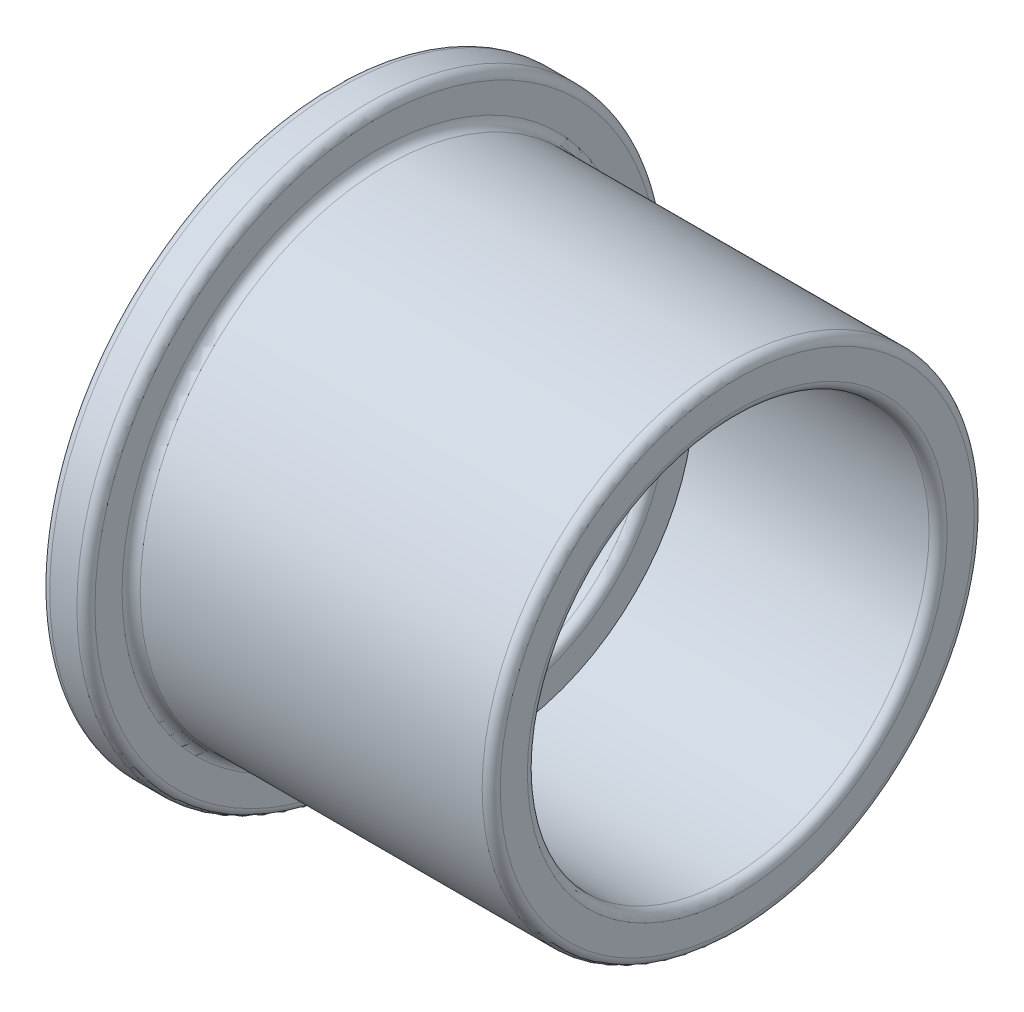
from build123d import *

# Parameters (mm, degrees)
FILLET1_R = 0.5


with BuildPart() as part:
    # Sketch1 → Revolve1 (revolve)
    with BuildSketch(Plane.XY, mode=Mode.PRIVATE) as revolve1_sk:
        Polygon((-12.5, 16.1), (-12.5, 9.1), (-3.6, 9.1), (-3.6, 11.1), (9.9, 11.1), (9.9, 13.6), (-10, 13.6), (-10, 16.1), align=None)
    revolve(revolve1_sk.sketch.rotate(Axis((-30.849638619, 0, 0), (1, 0, 0)), 90), axis=Axis((-30.849638619, 0, 0), (1, 0, 0)))

    # Fillet1
    fillet1_edges = [part.edges().sort_by_distance(p)[0] for p in [
        (-12.5, 0, -16.1),
        (-10, 0, -16.1),
        (-10, 0, -13.6),
        (9.9, 0, -13.6),
        (9.9, 0, -11.1),
        (-3.6, 0, -9.1),
        (-12.5, 0, -9.1),
    ]]
    fillet(fillet1_edges, radius=FILLET1_R)


solid = part.part
